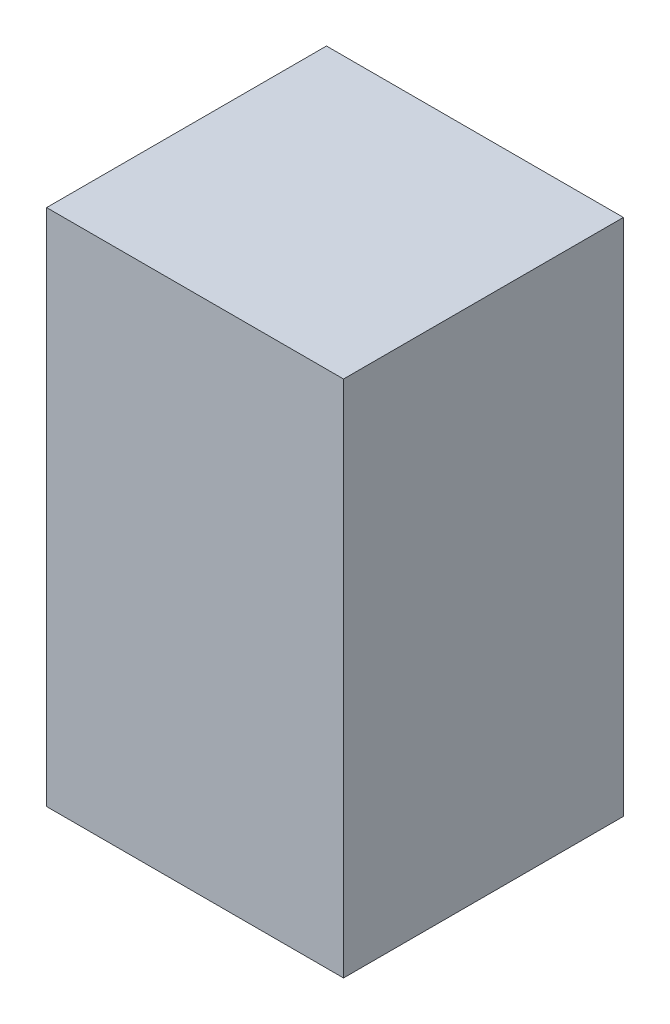
from build123d import *

# Parameters (mm, degrees)
SK_BOX_0_W  = 87
SK_BOX_0_H  = 152
BOX_0_DEPTH = 82


with BuildPart() as part:
    # SK_Box_0 → Box_0 (new body)
    with BuildSketch(Plane.XY.offset(8)):
        Rectangle(SK_BOX_0_W, SK_BOX_0_H)
    extrude(amount=BOX_0_DEPTH)


solid = part.part
